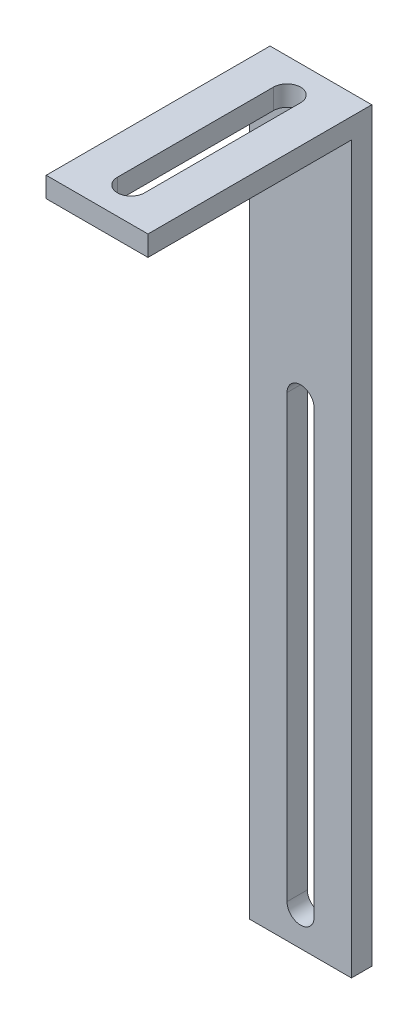
from build123d import *

# Parameters (mm, degrees)
SKETCH1_W           = 15
SKETCH1_H           = 110
BOSS_EXTRUDE1_DEPTH = 3
CUT_EXTRUDE1_DEPTH  = 3
SKETCH3_W           = 15
SKETCH3_H           = 3
BOSS_EXTRUDE2_DEPTH = 30
CUT_EXTRUDE2_DEPTH  = 30


with BuildPart() as part:
    # Sketch1 → Boss-Extrude1 (new body)
    with BuildSketch(Plane.XY):
        Rectangle(SKETCH1_W, SKETCH1_H)
    extrude(amount=BOSS_EXTRUDE1_DEPTH)

    # Sketch2 → Cut-Extrude1 (cut)
    with BuildSketch(Plane.XY.offset(3)):
        with BuildLine():
            Line((2, 15), (2, -50))
            ThreePointArc((2, -50), (0, -52), (-2, -50))
            Line((-2, -50), (-2, 15))
            ThreePointArc((-2, 15), (0, 17), (2, 15))
        make_face()
    extrude(amount=-CUT_EXTRUDE1_DEPTH, mode=Mode.SUBTRACT)

    # Sketch3 → Boss-Extrude2 (add)
    with BuildSketch(Plane.XY.offset(3)):
        with Locations((0, 53.5)):
            Rectangle(SKETCH3_W, SKETCH3_H)
    extrude(amount=BOSS_EXTRUDE2_DEPTH)

    # Sketch4 → Cut-Extrude2 (cut)
    with BuildSketch(Plane(origin=(0, 55, 0), x_dir=(1, 0, 0), z_dir=(0, 1, 0))):
        with BuildLine():
            Line((2, -5), (2, -28))
            ThreePointArc((2, -28), (0, -30), (-2, -28))
            Line((-2, -28), (-2, -5))
            ThreePointArc((-2, -5), (0, -3), (2, -5))
        make_face()
    extrude(amount=-CUT_EXTRUDE2_DEPTH, mode=Mode.SUBTRACT)


solid = part.part
